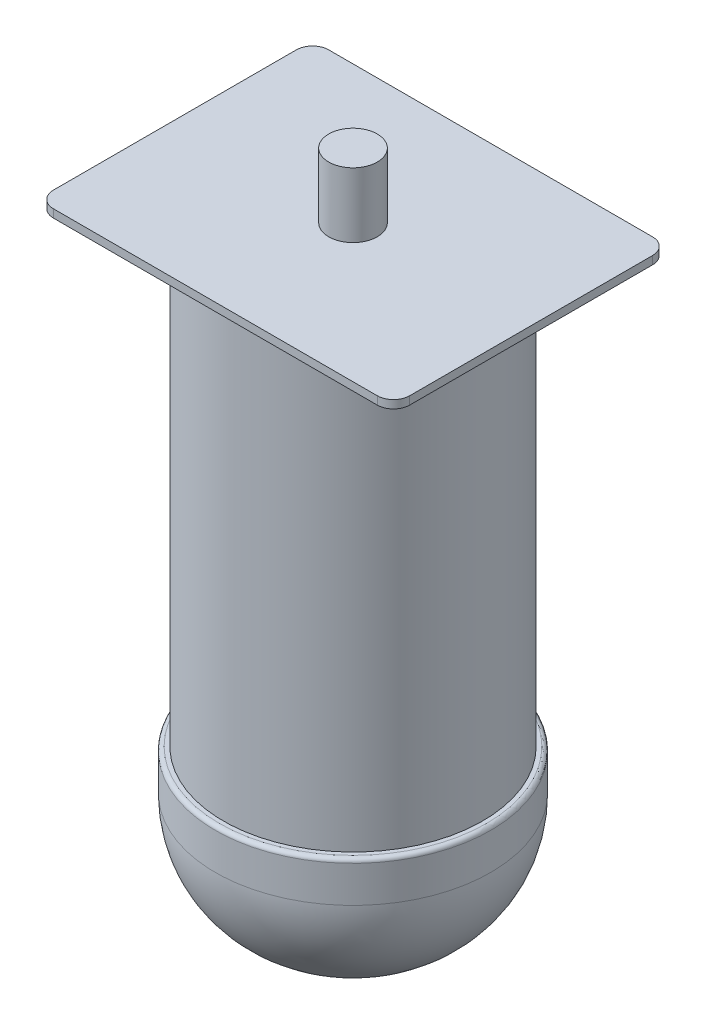
from build123d import *

# Parameters (mm, degrees)
BOSS_EXTRU_1_DEPTH = 1
ESQUISSE2_R        = 16
BOSS_EXTRU_2_DEPTH = 55
ESQUISSE3_R        = 17
BOSS_EXTRU_3_DEPTH = 20
CONG_1_R           = 15
CONG_2_R           = 0.5
ESQUISSE4_R        = 3
BOSS_EXTRU_4_DEPTH = 8


with BuildPart() as part:
    # Esquisse1 → Boss.-Extru.1 (new body)
    with BuildSketch(Plane(origin=(0, 0, 0), x_dir=(1, 0, 0), z_dir=(0, 1, 0))):
        with BuildLine():
            Line((2, 0), (42, 0))
            ThreePointArc((42, 0), (43.414213562, 0.585786438), (44, 2))
            Line((44, 2), (44, 32))
            ThreePointArc((44, 32), (43.414213562, 33.414213562), (42, 34))
            Line((42, 34), (2, 34))
            ThreePointArc((2, 34), (0.585786438, 33.414213562), (0, 32))
            Line((0, 32), (0, 2))
            ThreePointArc((0, 2), (0.585786438, 0.585786438), (2, 0))
        make_face()
    extrude(amount=BOSS_EXTRU_1_DEPTH)

    # Esquisse2 → Boss.-Extru.2 (add)
    with BuildSketch(Plane.XZ):
        with Locations(Location((22, -17, 0), (0, 0, 270))):
            Circle(ESQUISSE2_R)
    extrude(amount=BOSS_EXTRU_2_DEPTH)

    # Esquisse3 → Boss.-Extru.3 (add)
    with BuildSketch(Plane.XZ.offset(55)):
        with Locations(Location((22, -17, 0), (0, 0, 270))):
            Circle(ESQUISSE3_R)
    extrude(amount=BOSS_EXTRU_3_DEPTH)

    # Congé1
    cong_1_edges = [part.edges().sort_by_distance(p)[0] for p in [
        (22, -75, 0),
    ]]
    fillet(cong_1_edges, radius=CONG_1_R)

    # Congé2
    cong_2_edges = [part.edges().sort_by_distance(p)[0] for p in [
        (22, -55, 0),
    ]]
    fillet(cong_2_edges, radius=CONG_2_R)

    # Esquisse4 → Boss.-Extru.4 (add)
    with BuildSketch(Plane(origin=(0, 1, 0), x_dir=(1, 0, 0), z_dir=(0, 1, 0))):
        with Locations(Location((22, 17, 0), (0, 0, 90))):
            Circle(ESQUISSE4_R)
    extrude(amount=BOSS_EXTRU_4_DEPTH)


solid = part.part
